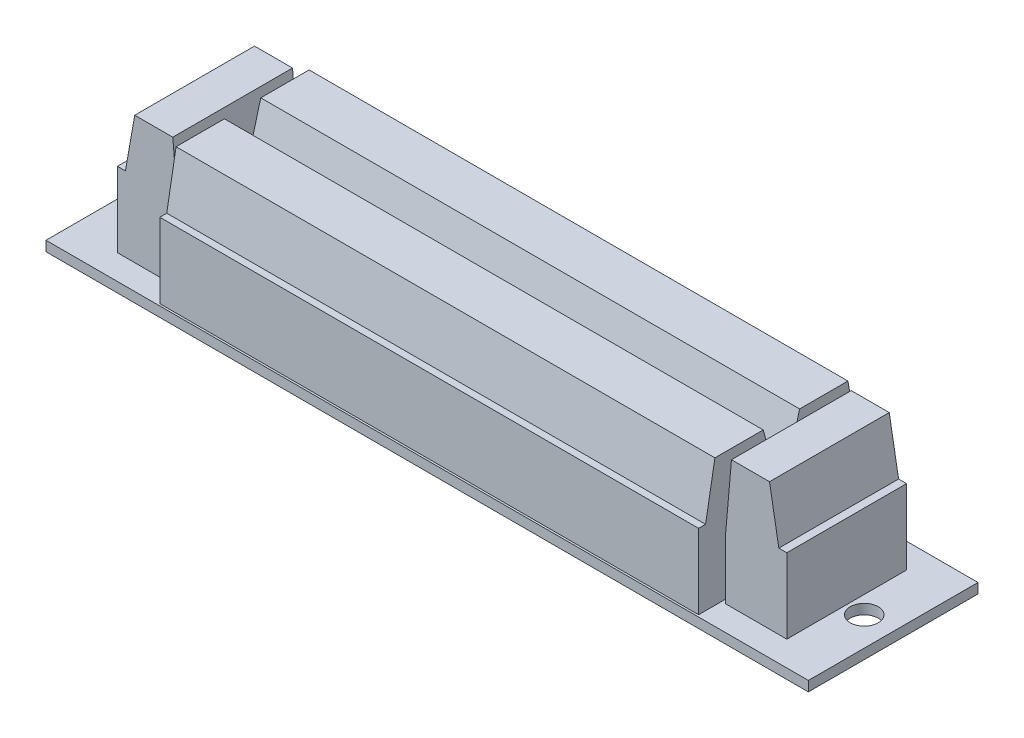
from build123d import *

# Parameters (mm, degrees)
SKETCH1_W           = 97.028
SKETCH1_H           = 21.59
SKETCH1_R           = 1.778
BOSS_EXTRUDE1_DEPTH = 0.635
BOSS_EXTRUDE2_DEPTH = 34.29
BOSS_EXTRUDE3_DEPTH = 7.62


with BuildPart() as part:
    # Sketch1 → Boss-Extrude1 (new, symmetric)
    with BuildSketch(Plane(origin=(0, 0, 0), x_dir=(1, 0, 0), z_dir=(0, 1, 0))):
        Rectangle(SKETCH1_W, SKETCH1_H)
        with Locations(Location((-44.831, 0, 0), (0, 0, 270))):
            Circle(SKETCH1_R, mode=Mode.SUBTRACT)
        with Locations(Location((44.831, 0, 0), (0, 0, 90))):
            Circle(SKETCH1_R, mode=Mode.SUBTRACT)
    extrude(amount=BOSS_EXTRUDE1_DEPTH, both=True)

    # Sketch2 → Boss-Extrude2 (add, symmetric)
    with BuildSketch(Plane(origin=(0, 0, 0), x_dir=(0, 0, -1), z_dir=(1, 0, 0))):
        Polygon((-10.541, 0.635), (-10.541, 10.16), (-9.652, 10.16), (-8.465143093, 16.891), (-2.314009226, 16.891), (0, 8.255), (2.314009226, 16.891), (8.465143093, 16.891), (9.652, 10.16), (10.541, 10.16), (10.541, 0.635), align=None)
    extrude(amount=BOSS_EXTRUDE2_DEPTH, both=True)

    # Sketch3 → Boss-Extrude3 (add, symmetric)
    with BuildSketch(Plane.XY):
        Polygon((-34.798, 0.635), (-34.798, 8.255), (-35.553552098, 16.891), (-40.393571647, 16.891), (-41.580428554, 10.16), (-42.596428554, 10.16), (-42.596428554, 0.635), align=None)
    boss_extrude3 = extrude(amount=BOSS_EXTRUDE3_DEPTH, both=True)

    # Mirror1: Boss-Extrude3 across plane
    add(boss_extrude3.mirror(Plane(origin=(0, 0, 0), x_dir=(0, 0, 1), z_dir=(1, 0, 0))))


solid = part.part
